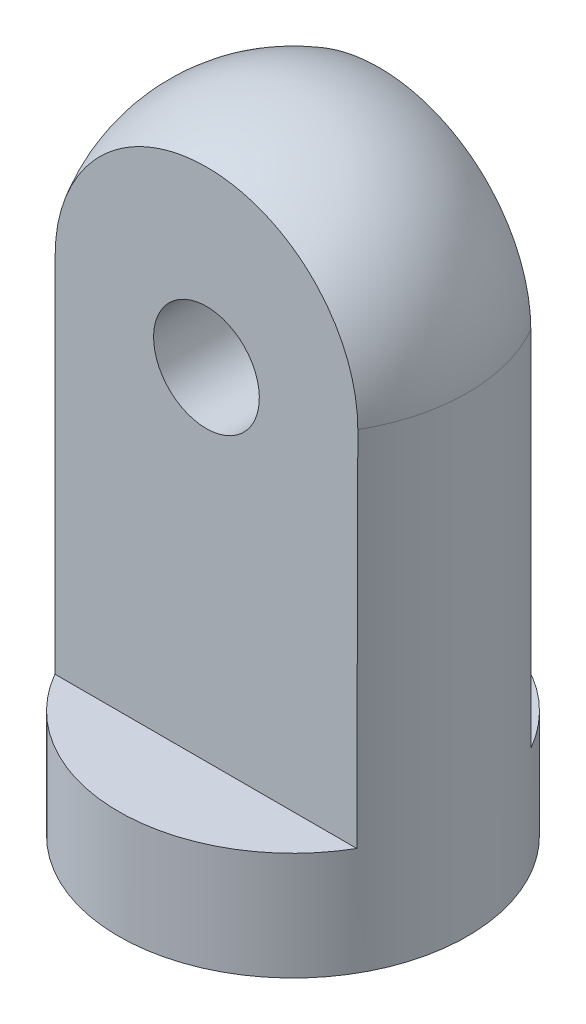
from build123d import *

# Parameters (mm, degrees)
CUT_EXTRUDE1_DEPTH      = 51.305467894
CUT_EXTRUDE2_DEPTH      = 53.265868848
CUT_EXTRUDE2_DEPTH_BACK = 53.265868848
SKETCH6_R               = 3.852050009


with BuildPart() as part:
    # Sketch3 → Revolve1 (revolve)
    with BuildSketch(Plane.XY):
        with BuildLine():
            Line((0, 46.99), (0, 0))
            Line((0, 0), (12.7, 0))
            Line((12.7, 0), (12.7, 34.29))
            ThreePointArc((12.7, 34.29), (8.980256121, 43.270256121), (0, 46.99))
        make_face()
    revolve(axis=Axis((0, 46.99, 0), (0, -1, 0)))

    # Sketch4 → Cut-Extrude1 (cut, symmetric)
    with BuildSketch(Plane(origin=(0, 0, 0), x_dir=(0, 0, -1), z_dir=(1, 0, 0))):
        Polygon((-6.28327957, 45.326774794), (-6.35, 7.872595515), (-12.7, 7.872595515), (-15.471425878, 7.872595515), (-17.507867096, 7.199216011), (-21.88483387, 7.199216011), (-21.88483387, 45.326774794), align=None)
    cut_extrude1 = extrude(amount=CUT_EXTRUDE1_DEPTH, both=True, mode=Mode.SUBTRACT)

    # Mirror1: Cut-Extrude1 across plane
    add(cut_extrude1.mirror(Plane.XY), mode=Mode.SUBTRACT)

    # Sketch6 → Cut-Extrude2 (cut, two sides: drawn at the far end of the back side and taken through both)
    with BuildSketch(Plane(origin=(0, 0.011336761, 6.364003953), x_dir=(1, 0, 0), z_dir=(0, 0.0017813853062925587, 0.9999984133319366)).offset(-CUT_EXTRUDE2_DEPTH_BACK)):
        with Locations(Location((0, 32.687978784, 0), (0, 0, 270))):
            Circle(SKETCH6_R)
    extrude(amount=CUT_EXTRUDE2_DEPTH + CUT_EXTRUDE2_DEPTH_BACK, mode=Mode.SUBTRACT)


solid = part.part
